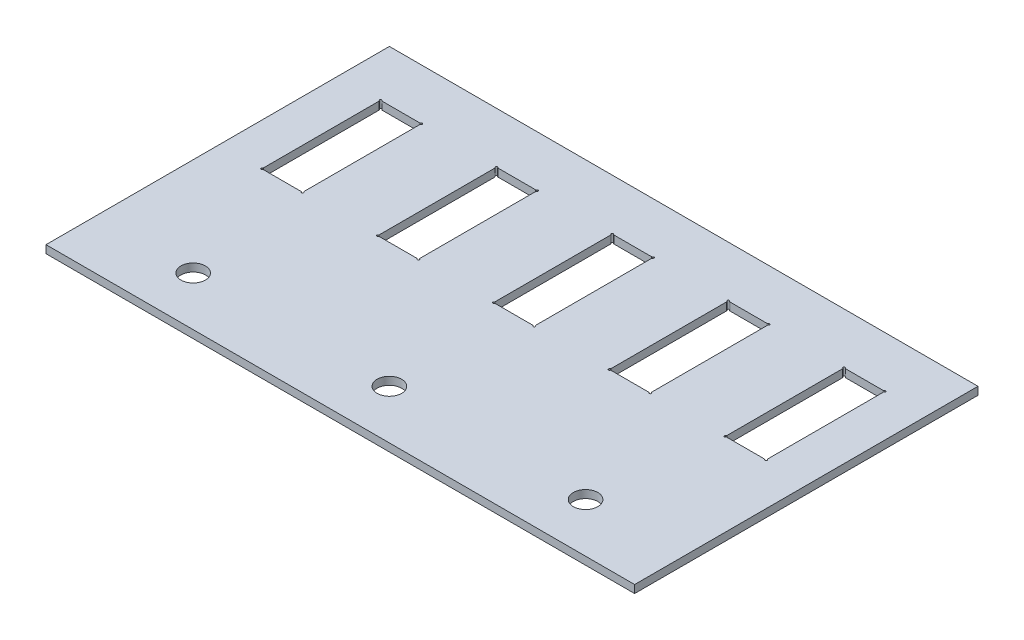
from build123d import *

# Parameters (mm, degrees)
SKETCH1_W           = 152.4
SKETCH1_H           = 88.9
SKETCH1_R           = 3.175
BOSS_EXTRUDE1_DEPTH = 2.032
CUT_EXTRUDE1_DEPTH  = 177.445739603


with BuildPart() as part:
    # Sketch1 → Boss-Extrude1 (new body)
    with BuildSketch(Plane(origin=(0, 0, 0), x_dir=(1, 0, 0), z_dir=(0, 1, 0))):
        with Locations((76.2, 44.45)):
            Rectangle(SKETCH1_W, SKETCH1_H)
        with Locations(Location((76.2, 12.7, 0), (0, 0, 270))):
            Circle(SKETCH1_R, mode=Mode.SUBTRACT)
        with Locations(Location((25.4, 12.7, 0), (0, 0, 270))):
            Circle(SKETCH1_R, mode=Mode.SUBTRACT)
        with Locations(Location((127, 12.7, 0), (0, 0, 90))):
            Circle(SKETCH1_R, mode=Mode.SUBTRACT)
    extrude(amount=BOSS_EXTRUDE1_DEPTH)

    # Sketch2 → Cut-Extrude1 (cut, through all)
    with BuildSketch(Plane.XZ):
        with BuildLine():
            ThreePointArc((141.5955, -45.174506351), (141.647276695, -44.781223305), (141.253993649, -44.833))
            ThreePointArc((141.253993649, -44.833), (141.162487298, -44.924506351), (141.037487298, -44.958))
            Line((141.037487298, -44.958), (131.362512702, -44.958))
            ThreePointArc((131.362512702, -44.958), (131.237512702, -44.924506351), (131.146006351, -44.833))
            ThreePointArc((131.146006351, -44.833), (130.752723305, -44.781223305), (130.8045, -45.174506351))
            ThreePointArc((130.8045, -45.174506351), (130.896006351, -45.266012702), (130.9295, -45.391012702))
            Line((130.9295, -45.391012702), (130.9295, -75.258987298))
            ThreePointArc((130.9295, -75.258987298), (130.896006351, -75.383987298), (130.8045, -75.475493649))
            ThreePointArc((130.8045, -75.475493649), (130.752723305, -75.868776695), (131.146006351, -75.817))
            ThreePointArc((131.146006351, -75.817), (131.237512702, -75.725493649), (131.362512702, -75.692))
            Line((131.362512702, -75.692), (141.037487298, -75.692))
            ThreePointArc((141.037487298, -75.692), (141.162487298, -75.725493649), (141.253993649, -75.817))
            ThreePointArc((141.253993649, -75.817), (141.647276695, -75.868776695), (141.5955, -75.475493649))
            ThreePointArc((141.5955, -75.475493649), (141.503993649, -75.383987298), (141.4705, -75.258987298))
            Line((141.4705, -75.258987298), (141.4705, -45.391012702))
            ThreePointArc((141.4705, -45.391012702), (141.503993649, -45.266012702), (141.5955, -45.174506351))
        make_face()
        with BuildLine():
            ThreePointArc((111.5955, -45.174506351), (111.647276695, -44.781223305), (111.253993649, -44.833))
            ThreePointArc((111.253993649, -44.833), (111.162487298, -44.924506351), (111.037487298, -44.958))
            Line((111.037487298, -44.958), (101.362512702, -44.958))
            ThreePointArc((101.362512702, -44.958), (101.237512702, -44.924506351), (101.146006351, -44.833))
            ThreePointArc((101.146006351, -44.833), (100.752723305, -44.781223305), (100.8045, -45.174506351))
            ThreePointArc((100.8045, -45.174506351), (100.896006351, -45.266012702), (100.9295, -45.391012702))
            Line((100.9295, -45.391012702), (100.9295, -75.258987298))
            ThreePointArc((100.9295, -75.258987298), (100.896006351, -75.383987298), (100.8045, -75.475493649))
            ThreePointArc((100.8045, -75.475493649), (100.752723305, -75.868776695), (101.146006351, -75.817))
            ThreePointArc((101.146006351, -75.817), (101.237512702, -75.725493649), (101.362512702, -75.692))
            Line((101.362512702, -75.692), (111.037487298, -75.692))
            ThreePointArc((111.037487298, -75.692), (111.162487298, -75.725493649), (111.253993649, -75.817))
            ThreePointArc((111.253993649, -75.817), (111.647276695, -75.868776695), (111.5955, -75.475493649))
            ThreePointArc((111.5955, -75.475493649), (111.503993649, -75.383987298), (111.4705, -75.258987298))
            Line((111.4705, -75.258987298), (111.4705, -45.391012702))
            ThreePointArc((111.4705, -45.391012702), (111.503993649, -45.266012702), (111.5955, -45.174506351))
        make_face()
        with BuildLine():
            ThreePointArc((81.5955, -45.174506351), (81.647276695, -44.781223305), (81.253993649, -44.833))
            ThreePointArc((81.253993649, -44.833), (81.162487298, -44.924506351), (81.037487298, -44.958))
            Line((81.037487298, -44.958), (71.362512702, -44.958))
            ThreePointArc((71.362512702, -44.958), (71.237512702, -44.924506351), (71.146006351, -44.833))
            ThreePointArc((71.146006351, -44.833), (70.752723305, -44.781223305), (70.8045, -45.174506351))
            ThreePointArc((70.8045, -45.174506351), (70.896006351, -45.266012702), (70.9295, -45.391012702))
            Line((70.9295, -45.391012702), (70.9295, -75.258987298))
            ThreePointArc((70.9295, -75.258987298), (70.896006351, -75.383987298), (70.8045, -75.475493649))
            ThreePointArc((70.8045, -75.475493649), (70.752723305, -75.868776695), (71.146006351, -75.817))
            ThreePointArc((71.146006351, -75.817), (71.237512702, -75.725493649), (71.362512702, -75.692))
            Line((71.362512702, -75.692), (81.037487298, -75.692))
            ThreePointArc((81.037487298, -75.692), (81.162487298, -75.725493649), (81.253993649, -75.817))
            ThreePointArc((81.253993649, -75.817), (81.647276695, -75.868776695), (81.5955, -75.475493649))
            ThreePointArc((81.5955, -75.475493649), (81.503993649, -75.383987298), (81.4705, -75.258987298))
            Line((81.4705, -75.258987298), (81.4705, -45.391012702))
            ThreePointArc((81.4705, -45.391012702), (81.503993649, -45.266012702), (81.5955, -45.174506351))
        make_face()
        with BuildLine():
            ThreePointArc((51.5955, -45.174506351), (51.647276695, -44.781223305), (51.253993649, -44.833))
            ThreePointArc((51.253993649, -44.833), (51.162487298, -44.924506351), (51.037487298, -44.958))
            Line((51.037487298, -44.958), (41.362512702, -44.958))
            ThreePointArc((41.362512702, -44.958), (41.237512702, -44.924506351), (41.146006351, -44.833))
            ThreePointArc((41.146006351, -44.833), (40.752723305, -44.781223305), (40.8045, -45.174506351))
            ThreePointArc((40.8045, -45.174506351), (40.896006351, -45.266012702), (40.9295, -45.391012702))
            Line((40.9295, -45.391012702), (40.9295, -75.258987298))
            ThreePointArc((40.9295, -75.258987298), (40.896006351, -75.383987298), (40.8045, -75.475493649))
            ThreePointArc((40.8045, -75.475493649), (40.752723305, -75.868776695), (41.146006351, -75.817))
            ThreePointArc((41.146006351, -75.817), (41.237512702, -75.725493649), (41.362512702, -75.692))
            Line((41.362512702, -75.692), (51.037487298, -75.692))
            ThreePointArc((51.037487298, -75.692), (51.162487298, -75.725493649), (51.253993649, -75.817))
            ThreePointArc((51.253993649, -75.817), (51.647276695, -75.868776695), (51.5955, -75.475493649))
            ThreePointArc((51.5955, -75.475493649), (51.503993649, -75.383987298), (51.4705, -75.258987298))
            Line((51.4705, -75.258987298), (51.4705, -45.391012702))
            ThreePointArc((51.4705, -45.391012702), (51.503993649, -45.266012702), (51.5955, -45.174506351))
        make_face()
        with BuildLine():
            ThreePointArc((21.5955, -45.174506351), (21.647276695, -44.781223305), (21.253993649, -44.833))
            ThreePointArc((21.253993649, -44.833), (21.162487298, -44.924506351), (21.037487298, -44.958))
            Line((21.037487298, -44.958), (11.362512702, -44.958))
            ThreePointArc((11.362512702, -44.958), (11.237512702, -44.924506351), (11.146006351, -44.833))
            ThreePointArc((11.146006351, -44.833), (10.752723305, -44.781223305), (10.8045, -45.174506351))
            ThreePointArc((10.8045, -45.174506351), (10.896006351, -45.266012702), (10.9295, -45.391012702))
            Line((10.9295, -45.391012702), (10.9295, -75.258987298))
            ThreePointArc((10.9295, -75.258987298), (10.896006351, -75.383987298), (10.8045, -75.475493649))
            ThreePointArc((10.8045, -75.475493649), (10.752723305, -75.868776695), (11.146006351, -75.817))
            ThreePointArc((11.146006351, -75.817), (11.237512702, -75.725493649), (11.362512702, -75.692))
            Line((11.362512702, -75.692), (21.037487298, -75.692))
            ThreePointArc((21.037487298, -75.692), (21.162487298, -75.725493649), (21.253993649, -75.817))
            ThreePointArc((21.253993649, -75.817), (21.647276695, -75.868776695), (21.5955, -75.475493649))
            ThreePointArc((21.5955, -75.475493649), (21.503993649, -75.383987298), (21.4705, -75.258987298))
            Line((21.4705, -75.258987298), (21.4705, -45.391012702))
            ThreePointArc((21.4705, -45.391012702), (21.503993649, -45.266012702), (21.5955, -45.174506351))
        make_face()
    extrude(amount=-CUT_EXTRUDE1_DEPTH, mode=Mode.SUBTRACT)


solid = part.part
